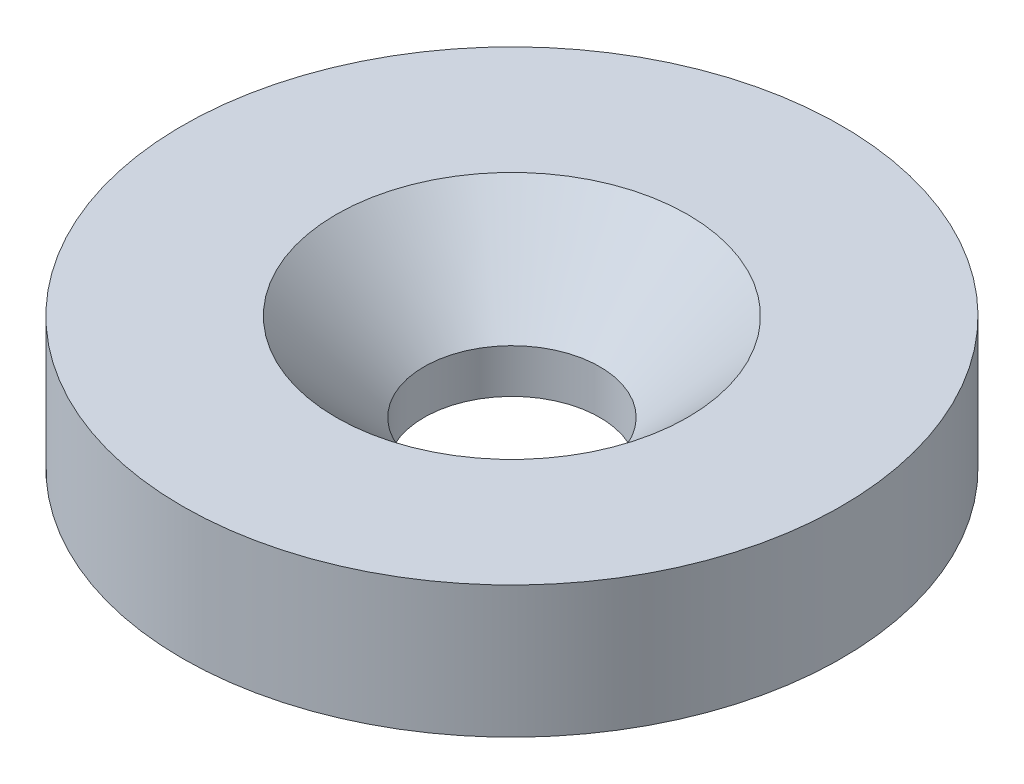
from build123d import *

# Parameters (mm, degrees)
SCHIZZO1_R                                           = 7.5
ESTRUSIONE_ESTRUSIONE1_DEPTH                         = 3
FORO_SVASATO_PER_VITE_M4_A_TESTA_SVASATA_D           = 4
FORO_SVASATO_PER_VITE_M4_A_TESTA_SVASATA_DEPTH       = 9
FORO_SVASATO_PER_VITE_M4_A_TESTA_SVASATA_CSINK_D     = 8
FORO_SVASATO_PER_VITE_M4_A_TESTA_SVASATA_CSINK_ANGLE = 90
FORO_SVASATO_PER_VITE_M4_A_TESTA_SVASATA_TIP         = 1.201721238


with BuildPart() as part:
    # Schizzo1 → Estrusione-Estrusione1 (new body)
    with BuildSketch(Plane(origin=(0, 0, 0), x_dir=(1, 0, 0), z_dir=(0, 1, 0))):
        with Locations(Location((0, 0, 0), (0, 0, 270))):
            Circle(SCHIZZO1_R)
    extrude(amount=ESTRUSIONE_ESTRUSIONE1_DEPTH)

    # Foro svasato per Vite M4 a testa svasata cilindrica1
    with Locations(Plane.ZX.offset(3)):
        with Locations((0, 0)):
            CounterSinkHole(FORO_SVASATO_PER_VITE_M4_A_TESTA_SVASATA_D / 2, FORO_SVASATO_PER_VITE_M4_A_TESTA_SVASATA_CSINK_D / 2, depth=FORO_SVASATO_PER_VITE_M4_A_TESTA_SVASATA_DEPTH, counter_sink_angle=FORO_SVASATO_PER_VITE_M4_A_TESTA_SVASATA_CSINK_ANGLE)
            with Locations((0, 0, -(FORO_SVASATO_PER_VITE_M4_A_TESTA_SVASATA_DEPTH + FORO_SVASATO_PER_VITE_M4_A_TESTA_SVASATA_TIP / 2))):  # 118° drill point
                Cone(0, FORO_SVASATO_PER_VITE_M4_A_TESTA_SVASATA_D / 2, FORO_SVASATO_PER_VITE_M4_A_TESTA_SVASATA_TIP, mode=Mode.SUBTRACT)


solid = part.part
